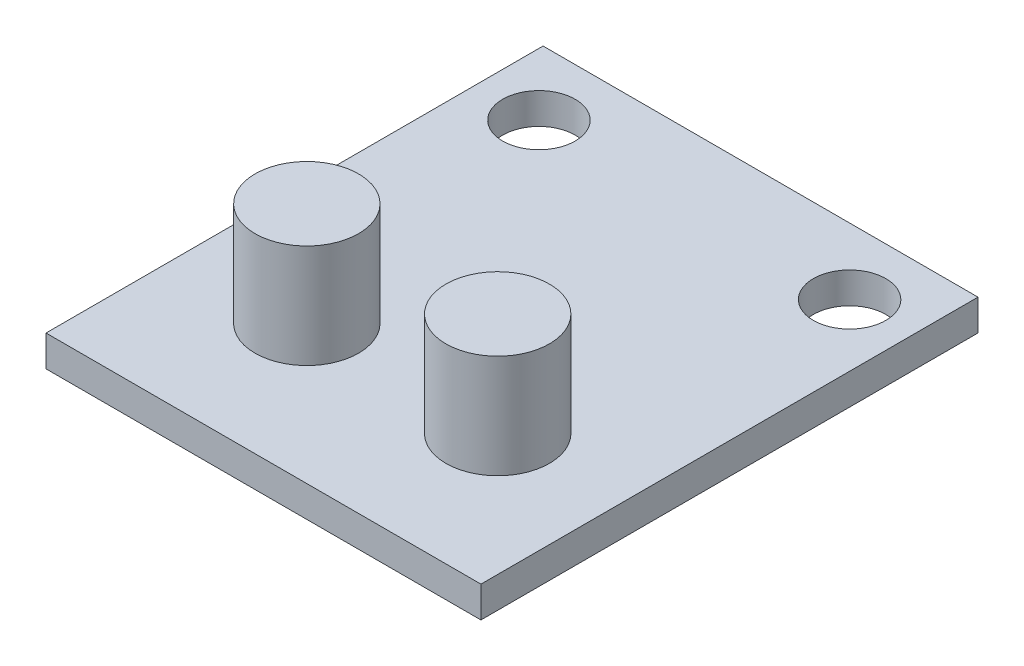
from build123d import *

# Parameters (mm, degrees)
SKETCH_1_W          = 21
SKETCH_1_H          = 24
EXTRUDE_1_DEPTH     = 1.5
SKETCH_2_R          = 1.75
CUT_EXTRUDE_1_DEPTH = 1.5
SKETCH_3_R          = 2.5
EXTRUDE_2_DEPTH     = 5


with BuildPart() as part:
    # 草图1 → 凸台-拉伸1 (new body)
    with BuildSketch(Plane(origin=(0, 0, 0), x_dir=(1, 0, 0), z_dir=(0, 1, 0))):
        Rectangle(SKETCH_1_W, SKETCH_1_H)
    extrude(amount=EXTRUDE_1_DEPTH)

    # 草图2 → 切除-拉伸1 (cut)
    with BuildSketch(Plane(origin=(0, 1.5, 0), x_dir=(1, 0, 0), z_dir=(0, 1, 0))):
        with Locations(Location((-7.5, 8.800641953, 0), (0, 0, 270))):
            Circle(SKETCH_2_R)
        with Locations(Location((7.5, 8.800641953, 0), (0, 0, 270))):
            Circle(SKETCH_2_R)
    extrude(amount=-CUT_EXTRUDE_1_DEPTH, mode=Mode.SUBTRACT)

    # 草图3 → 凸台-拉伸2 (add)
    with BuildSketch(Plane(origin=(0, 1.5, 0), x_dir=(1, 0, 0), z_dir=(0, 1, 0))):
        with Locations(Location((-4.607665944, -5.298815836, 0), (0, 0, 270))):
            Circle(SKETCH_3_R)
        with Locations(Location((4.607665944, -5.298815836, 0), (0, 0, 270))):
            Circle(SKETCH_3_R)
    extrude(amount=EXTRUDE_2_DEPTH)


solid = part.part
